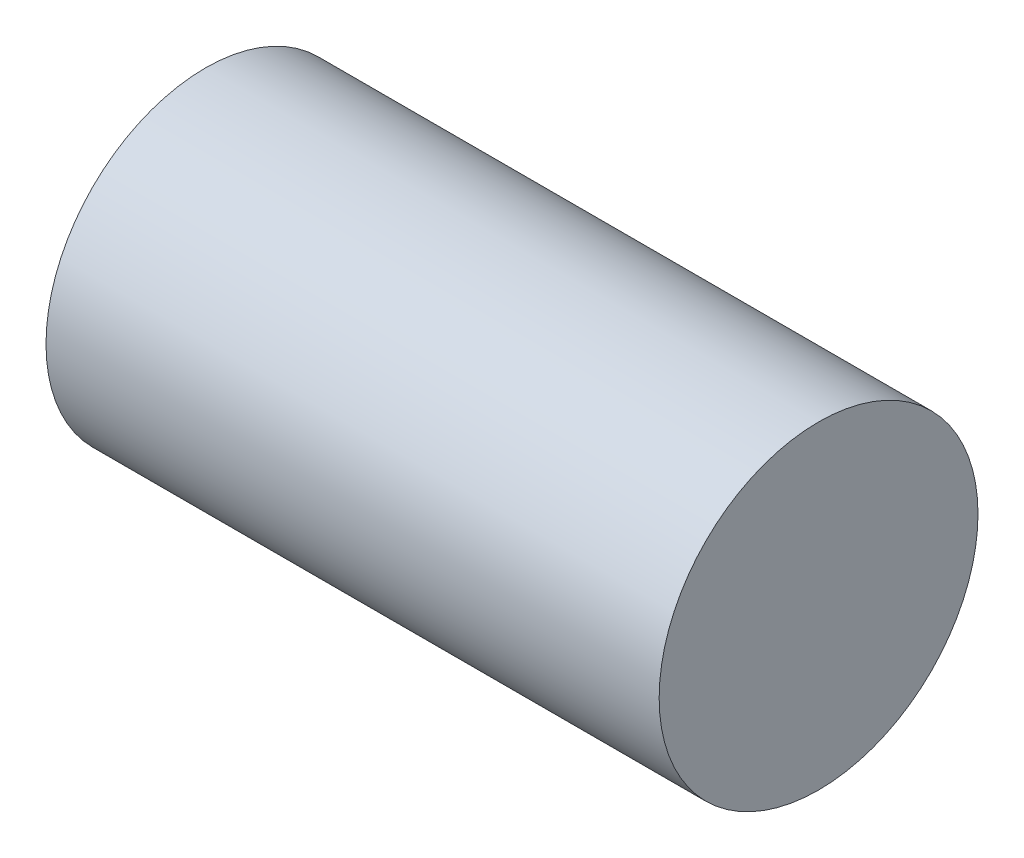
from build123d import *

# Parameters (mm, degrees)
SKICA1_R                = 26
P_IDAT_VYSUNUT_M1_DEPTH = 100


with BuildPart() as part:
    # Skica1 → Přidat vysunutím1 (new body)
    with BuildSketch(Plane(origin=(0, 0, 0), x_dir=(0, 0, -1), z_dir=(1, 0, 0))):
        Circle(SKICA1_R)
    extrude(amount=-P_IDAT_VYSUNUT_M1_DEPTH)


solid = part.part
